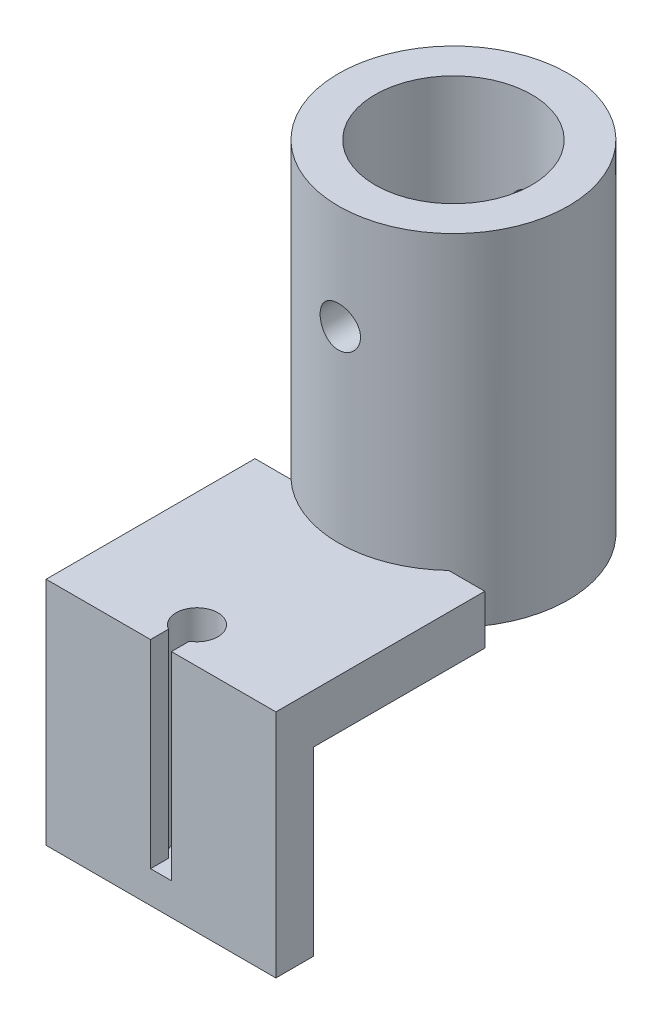
from build123d import *

# Parameters (mm, degrees)
SKETCH_1_R           = 11
EXTRUDE_1_DEPTH      = 50
SKETCH_2_R           = 7.5
CUT_EXTRUDE_1_DEPTH  = 53.364109846
SKETCH_4_R           = 1.935
CUT_EXTRUDE_4_DEPTH  = 50
EXTRUDE_2_DEPTH      = 10
EXTRUDE_2_DEPTH_BACK = 10
SKETCH_11_W          = 22
SKETCH_11_H          = 22.065
SKETCH_35_W          = 2
SKETCH_35_H          = 4.895889032
CUT_EXTRUDE_5_DEPTH  = 19
SKETCH_36_R          = 2
CUT_EXTRUDE_6_DEPTH  = 19
SKETCH_38_W          = 35.522416841
SKETCH_38_H          = 17.874337136
CUT_EXTRUDE_7_DEPTH  = 29


with BuildPart() as part:
    # 草圖1 → 填料-伸長1 (new body)
    with BuildSketch(Plane(origin=(0, 0, 0), x_dir=(1, 0, 0), z_dir=(0, 1, 0))):
        Circle(SKETCH_1_R)
    extrude(amount=EXTRUDE_1_DEPTH)

    # 草圖2 → 除料-伸長1 (cut, through all)
    with BuildSketch(Plane(origin=(0, 50, 0), x_dir=(1, 0, 0), z_dir=(0, 1, 0))):
        Circle(SKETCH_2_R)
    extrude(amount=-CUT_EXTRUDE_1_DEPTH, mode=Mode.SUBTRACT)

    # 草圖4 → 除料-伸長4 (cut)
    with BuildSketch(Plane.XY.offset(18)):
        with Locations((0, 40)):
            Circle(SKETCH_4_R)
    extrude(amount=-CUT_EXTRUDE_4_DEPTH, mode=Mode.SUBTRACT)

    # 草圖11 → 填料-伸長2 (add, two sides: drawn at the far end of the back side and taken through both)
    with BuildSketch(Plane.XY.offset(18).offset(-EXTRUDE_2_DEPTH_BACK)):
        with Locations((0, 11.0325)):
            Rectangle(SKETCH_11_W, SKETCH_11_H)
    extrude(amount=EXTRUDE_2_DEPTH + EXTRUDE_2_DEPTH_BACK)

    # 草圖35 → 除料-伸長5 (cut)
    with BuildSketch(Plane(origin=(0, 22.065, 0), x_dir=(1, 0, 0), z_dir=(0, 1, 0))):
        with Locations((0, -28)):
            Rectangle(SKETCH_35_W, SKETCH_35_H)
    extrude(amount=-CUT_EXTRUDE_5_DEPTH, mode=Mode.SUBTRACT)

    # 草圖36 → 除料-伸長6 (cut)
    with BuildSketch(Plane(origin=(0, 22.065, 0), x_dir=(1, 0, 0), z_dir=(0, 1, 0))):
        with Locations((0, -24.552055484)):
            Circle(SKETCH_36_R)
    extrude(amount=-CUT_EXTRUDE_6_DEPTH, mode=Mode.SUBTRACT)

    # 草圖38 → 除料-伸長7 (cut)
    with BuildSketch(Plane(origin=(11, 0, 0), x_dir=(0, 0, -1), z_dir=(1, 0, 0))):
        with Locations((-6.652230971, 8.407788312)):
            Rectangle(SKETCH_38_W, SKETCH_38_H)
    extrude(amount=-CUT_EXTRUDE_7_DEPTH, mode=Mode.SUBTRACT)


solid = part.part
